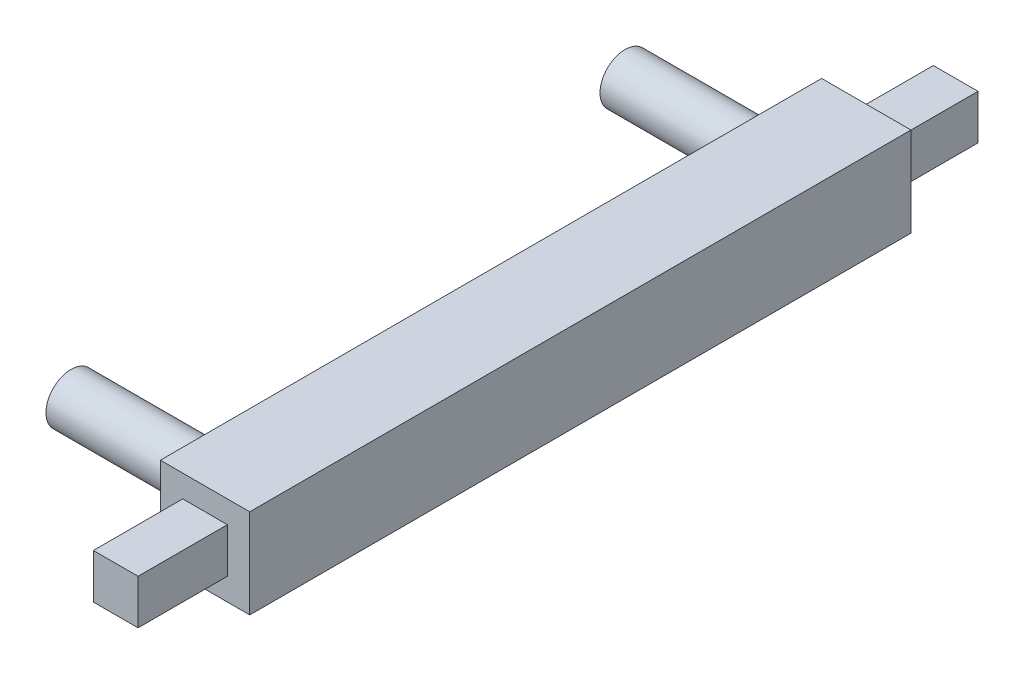
from build123d import *

# Parameters (mm, degrees)
SKETCH1_W           = 5
SKETCH1_H           = 5
BOSS_EXTRUDE1_DEPTH = 37
SKETCH2_W           = 2.5
SKETCH2_H           = 2.5
BOSS_EXTRUDE2_DEPTH = 5
SKETCH3_W           = 2.5
SKETCH3_H           = 2.5
BOSS_EXTRUDE3_DEPTH = 5
SKETCH4_R           = 1.4
BOSS_EXTRUDE4_DEPTH = 8


with BuildPart() as part:
    # Sketch1 → Boss-Extrude1 (new body)
    with BuildSketch(Plane.XY):
        with Locations((2.5, 2.5)):
            Rectangle(SKETCH1_W, SKETCH1_H)
    extrude(amount=BOSS_EXTRUDE1_DEPTH)

    # Sketch2 → Boss-Extrude2 (add)
    with BuildSketch(Plane.XY.offset(37)):
        with Locations((2.5, 2.5)):
            Rectangle(SKETCH2_W, SKETCH2_H)
    extrude(amount=BOSS_EXTRUDE2_DEPTH)

    # Sketch3 → Boss-Extrude3 (add)
    with BuildSketch(Plane(origin=(0, 0, 0), x_dir=(-1, 0, 0), z_dir=(0, 0, -1))):
        with Locations((-2.5, 2.5)):
            Rectangle(SKETCH3_W, SKETCH3_H)
    extrude(amount=BOSS_EXTRUDE3_DEPTH)

    # Sketch4 → Boss-Extrude4 (add)
    with BuildSketch(Plane.ZY):
        with Locations(Location((3, 2.5, 0), (0, 0, 180))):
            Circle(SKETCH4_R)
        with Locations(Location((34, 2.5, 0), (0, 0, 180))):
            Circle(SKETCH4_R)
    extrude(amount=BOSS_EXTRUDE4_DEPTH)


solid = part.part
